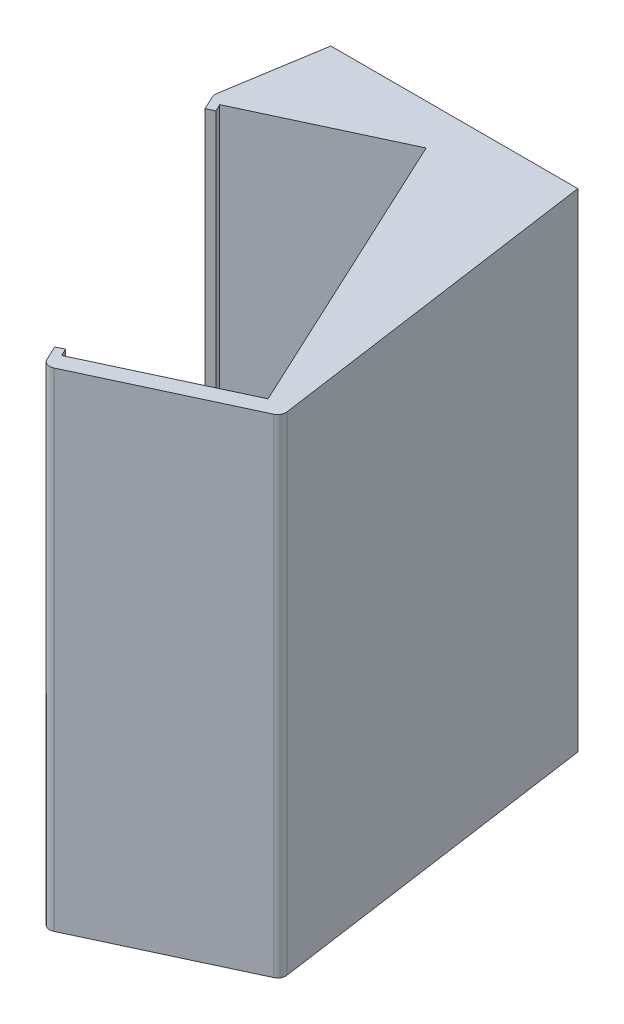
from build123d import *

# Parameters (mm, degrees)
BOSS_EXTRUDE1_DEPTH = 60
FILLET1_R           = 1


with BuildPart() as part:
    # Sketch2 → Boss-Extrude1 (new body)
    with BuildSketch(Plane(origin=(0, 0, 0), x_dir=(-1, 0, 0), z_dir=(0, 1, 0))):
        Polygon((0.743842872, 43.599274051), (1.650150659, 44.021892313), (0.382295874, 46.740815674), (-19.647106212, 37.400952093), (-13.647106212, -5), (16.726783574, -5), (18.726783574, 7.400934848), (17.794168258, 9.400934848), (16.887860471, 8.978316586), (17.310478732, 8.072008799), (0, 0), (-16.989254122, 36.433573039), (0.32122461, 44.505581838), align=None)
    extrude(amount=BOSS_EXTRUDE1_DEPTH)

    # Fillet1
    fillet1_edges = [part.edges().sort_by_distance(p)[0] for p in [
        (-18.726783574, 30, 7.400934848),
        (19.647106212, 30, 37.400952093),
        (-0.382295874, 30, 46.740815674),
    ]]
    fillet(fillet1_edges, radius=FILLET1_R)


solid = part.part
